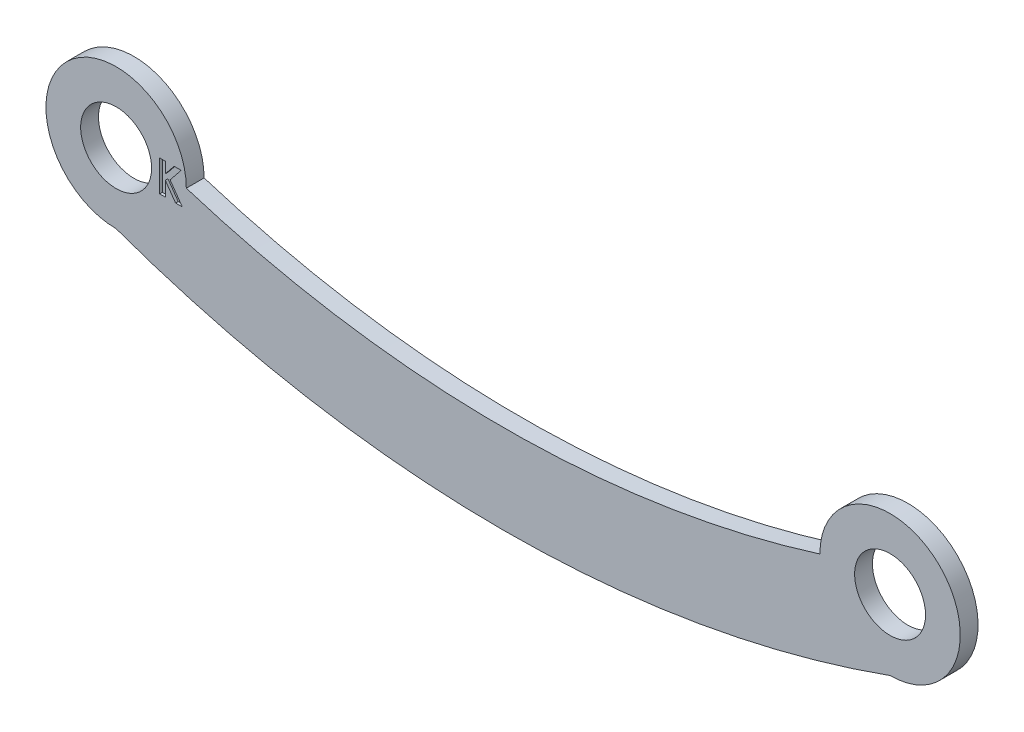
from build123d import *

# Parameters (mm, degrees)
ESQUISSE1_R             = 3.985
BOSS_EXTRU_1_DEPTH      = 2
ENL_V_MAT_EXTRU_1_DEPTH = 0.3


with BuildPart() as part:
    # Esquisse1 → Boss.-Extru.1 (new body)
    with BuildSketch(Plane(origin=(0, 0, 0), x_dir=(0, 1, 0), z_dir=(0, 0, 1))):
        with BuildLine():
            ThreePointArc((-7.89, 0), (5.579072504, -5.579072504), (0, 7.89))
            ThreePointArc((0, 7.89), (-5.478052173, 43.5), (0, 79.11))
            ThreePointArc((0, 79.11), (5.579072504, 92.579072504), (-7.89, 87))
            ThreePointArc((-7.89, 87), (-15.478052173, 43.5), (-7.89, 0))
        make_face()
        with Locations(Location((0, 0, 0), (0, 0, 270))):
            Circle(ESQUISSE1_R, mode=Mode.SUBTRACT)
        with Locations(Location((0, 87, 0), (0, 0, 270))):
            Circle(ESQUISSE1_R, mode=Mode.SUBTRACT)
    extrude(amount=BOSS_EXTRU_1_DEPTH)

    # Esquisse2 → Enlèv. mat.-Extru.1 (cut)
    with BuildSketch(Plane.XY.offset(2)):
        Polygon((-82.098700293, 1.451884906), (-81.470495165, 1.451884906), (-81.470495165, 0.220013912), (-80.477706704, 1.451884906), (-79.684737954, 1.451884906), (-80.932033627, -0.096192018), (-79.563443883, -2.048115094), (-80.3199543, -2.048115094), (-81.470495165, -0.406788973), (-81.470495165, -2.048115094), (-82.098700293, -2.048115094), align=None)
    extrude(amount=-ENL_V_MAT_EXTRU_1_DEPTH, mode=Mode.SUBTRACT)


solid = part.part
